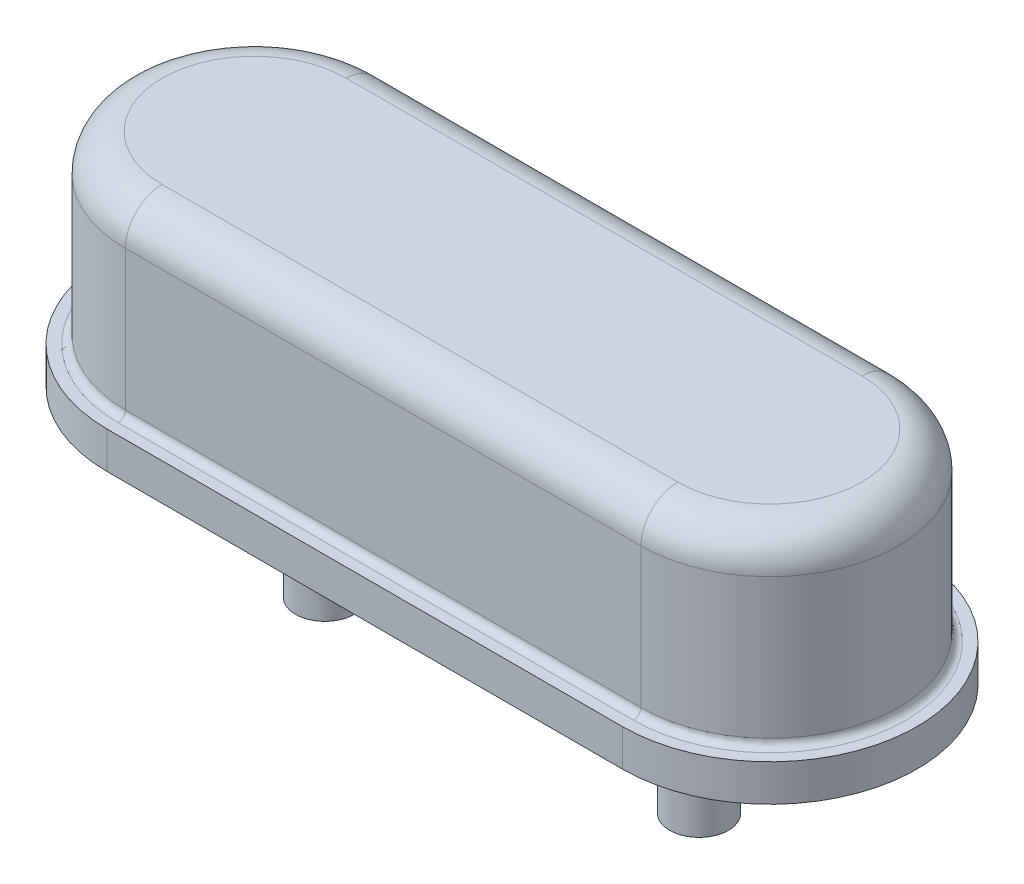
from build123d import *

# Parameters (mm, degrees)
BOSS_EXTRUDE1_DEPTH = 3
CUT_EXTRUDE1_START  = -2.5
CUT_EXTRUDE1_DEPTH  = 2.5
FILLET1_R           = 0.5
SKETCH3_R           = 0.4
BOSS_EXTRUDE2_DEPTH = 2
FILLET2_R           = 0.1


with BuildPart() as part:
    # Sketch1 → Boss-Extrude1 (new body)
    with BuildSketch(Plane(origin=(0, 0, 0), x_dir=(1, 0, 0), z_dir=(0, 1, 0))):
        with BuildLine():
            Line((-3.5, 2), (3.5, 2))
            ThreePointArc((3.5, 2), (5.5, 0), (3.5, -2))
            Line((3.5, -2), (-3.5, -2))
            ThreePointArc((-3.5, -2), (-5.5, 0), (-3.5, 2))
        make_face()
    extrude(amount=BOSS_EXTRUDE1_DEPTH)

    # Sketch2 → Cut-Extrude1 (cut)
    with BuildSketch(Plane(origin=(0, 3, 0), x_dir=(1, 0, 0), z_dir=(0, 1, 0)).offset(CUT_EXTRUDE1_START)):
        with BuildLine():
            Line((-3.5, -2), (3.5, -2))
            ThreePointArc((3.5, -2), (5.5, 0), (3.5, 2))
            Line((3.5, 2), (-3.5, 2))
            ThreePointArc((-3.5, 2), (-5.5, 0), (-3.5, -2))
        make_face()
        with BuildLine():
            Line((-3.5, -1.75), (3.5, -1.75))
            ThreePointArc((3.5, -1.75), (5.25, 0), (3.5, 1.75))
            Line((3.5, 1.75), (-3.5, 1.75))
            ThreePointArc((-3.5, 1.75), (-5.25, 0), (-3.5, -1.75))
        make_face(mode=Mode.SUBTRACT)
    extrude(amount=CUT_EXTRUDE1_DEPTH, mode=Mode.SUBTRACT)

    # Fillet1
    fillet1_edges = [part.edges().sort_by_distance(p)[0] for p in [
        (-5.25, 3, 0),
        (0, 3, -1.75),
        (5.25, 3, 0),
        (0, 3, 1.75),
    ]]
    fillet(fillet1_edges, radius=FILLET1_R)

    # Sketch3 → Boss-Extrude2 (add)
    with BuildSketch(Plane.XZ):
        with Locations(Location((-2.54, 0, 0), (0, 0, 90))):
            Circle(SKETCH3_R)
        with Locations(Location((2.54, 0, 0), (0, 0, 90))):
            Circle(SKETCH3_R)
    extrude(amount=BOSS_EXTRUDE2_DEPTH)

    # Fillet2
    fillet2_edges = [part.edges().sort_by_distance(p)[0] for p in [
        (0, 0.5, -1.75),
        (-5.25, 0.5, 0),
        (0, 0.5, 1.75),
        (5.25, 0.5, 0),
    ]]
    fillet(fillet2_edges, radius=FILLET2_R)


solid = part.part
